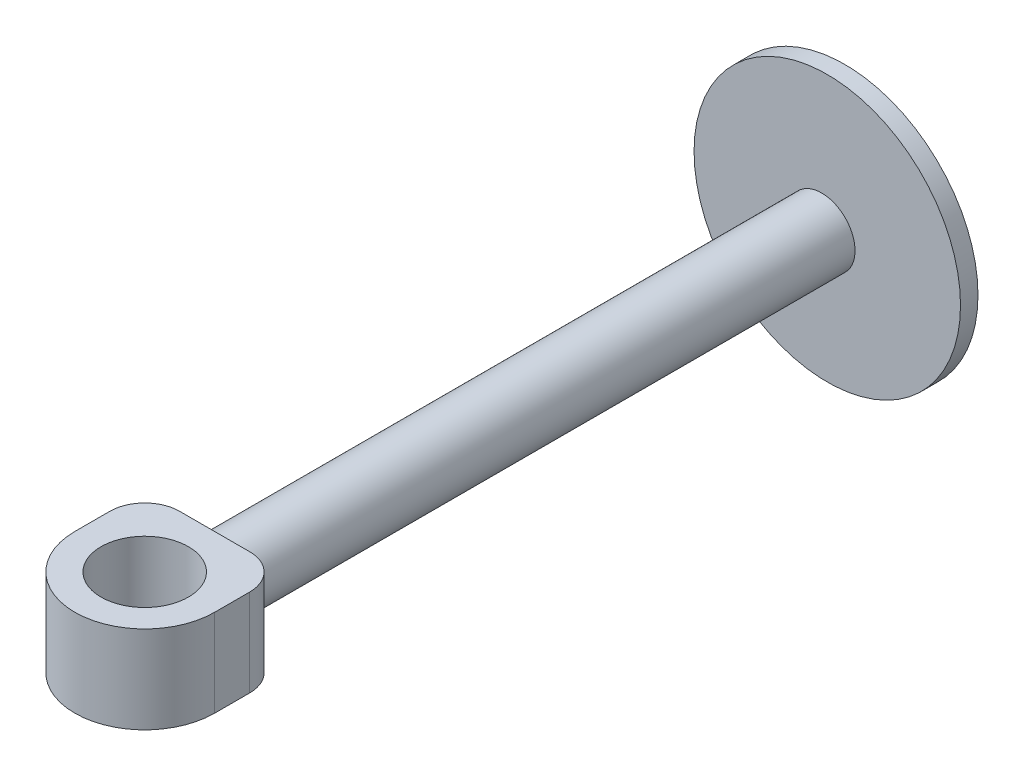
from build123d import *

# Parameters (mm, degrees)
DODANIE_WYCI_GNI_CIE2_DEPTH = 12.7
SZKIC3_R                    = 9.525
DODANIE_WYCI_GNI_CIE3_DEPTH = 173.6109
SZKIC4_R                    = 38.1
DODANIE_WYCI_GNI_CIE4_DEPTH = 5
SZKIC5_W                    = 40
SZKIC5_H                    = 25
DODANIE_WYCI_GNI_CIE5_DEPTH = 40
ZAOKR_GLENIE1_RADIUS        = 20
ZAOKR_GLENIE1_LENGTH        = 25
ZAOKR_GLENIE2_R             = 10
SZKIC6_R                    = 12.5
WYTNIJ_WYCI_GNI_CIE1_DEPTH  = 25


with BuildPart() as part:
    # Szkic2 → Dodanie-wyciągnięcie2 (new body)
    with BuildSketch(Plane(origin=(0, 0, 34.7218), x_dir=(-1, 0, 0), z_dir=(0, 0, -1))):
        with BuildLine():
            Line((6.264010277, -7.1755), (-6.264010277, -7.1755))
            ThreePointArc((-6.264010277, -7.1755), (-9.525, 0), (-6.264010277, 7.1755))
            Line((-6.264010277, 7.1755), (6.264010277, 7.1755))
            ThreePointArc((6.264010277, 7.1755), (9.525, 0), (6.264010277, -7.1755))
        make_face()
    extrude(amount=DODANIE_WYCI_GNI_CIE2_DEPTH)

    # Szkic3 → Dodanie-wyciągnięcie3 (add)
    with BuildSketch(Plane(origin=(0, 0, 22.0218), x_dir=(-1, 0, 0), z_dir=(0, 0, -1))):
        with Locations(Location((0, 0, 0), (0, 0, 131.120047553))):
            Circle(SZKIC3_R)
    extrude(amount=DODANIE_WYCI_GNI_CIE3_DEPTH)

    # Szkic5 → Dodanie-wyciągnięcie5 (add)
    with BuildSketch(Plane.XY.offset(22.0218)):
        Rectangle(SZKIC5_W, SZKIC5_H)
    extrude(amount=DODANIE_WYCI_GNI_CIE5_DEPTH)

    # Zaokrąglenie1: full round fillet: the end face becomes a half cylinder, R = half its width
    zaokr_glenie1_face = Plane((0, 0, 62.0218), x_dir=(0, 1, 0), z_dir=(0, 0, 1))  # on the end face: x along it, z out of the body
    zaokr_glenie1_slab = zaokr_glenie1_face.offset(-ZAOKR_GLENIE1_RADIUS / 2) * Box(ZAOKR_GLENIE1_LENGTH, 2 * ZAOKR_GLENIE1_RADIUS, ZAOKR_GLENIE1_RADIUS, mode=Mode.PRIVATE)  # the body's end, R deep
    zaokr_glenie1_round = Plane((0, 0, 42.0218), x_dir=(0, 0, 1), z_dir=(0, 1, 0)) * Cylinder(ZAOKR_GLENIE1_RADIUS, ZAOKR_GLENIE1_LENGTH, mode=Mode.PRIVATE)  # its axis R under the face
    add(zaokr_glenie1_slab - zaokr_glenie1_round, mode=Mode.SUBTRACT)

    # Zaokrąglenie2
    zaokr_glenie2_edges = [part.edges().sort_by_distance(p)[0] for p in [
        (20, 0, 22.0218),
        (-20, 0, 22.0218),
    ]]
    fillet(zaokr_glenie2_edges, radius=ZAOKR_GLENIE2_R)

    # Szkic6 → Wytnij-wyciągnięcie1 (cut)
    with BuildSketch(Plane(origin=(0, 12.5, 0), x_dir=(1, 0, 0), z_dir=(0, 1, 0))):
        with Locations(Location((0, -42.0218, 0), (0, 0, 270))):
            Circle(SZKIC6_R)
    extrude(amount=-WYTNIJ_WYCI_GNI_CIE1_DEPTH, mode=Mode.SUBTRACT)


with BuildPart() as body_2:
    # Szkic4 → Dodanie-wyciągnięcie4 (new body)
    with BuildSketch(Plane.XY.offset(-153.1766)):
        with Locations(Location((0, 0, 0), (0, 0, 180))):
            Circle(SZKIC4_R)
    extrude(amount=-DODANIE_WYCI_GNI_CIE4_DEPTH)


solid = Compound([part.part, body_2.part])
